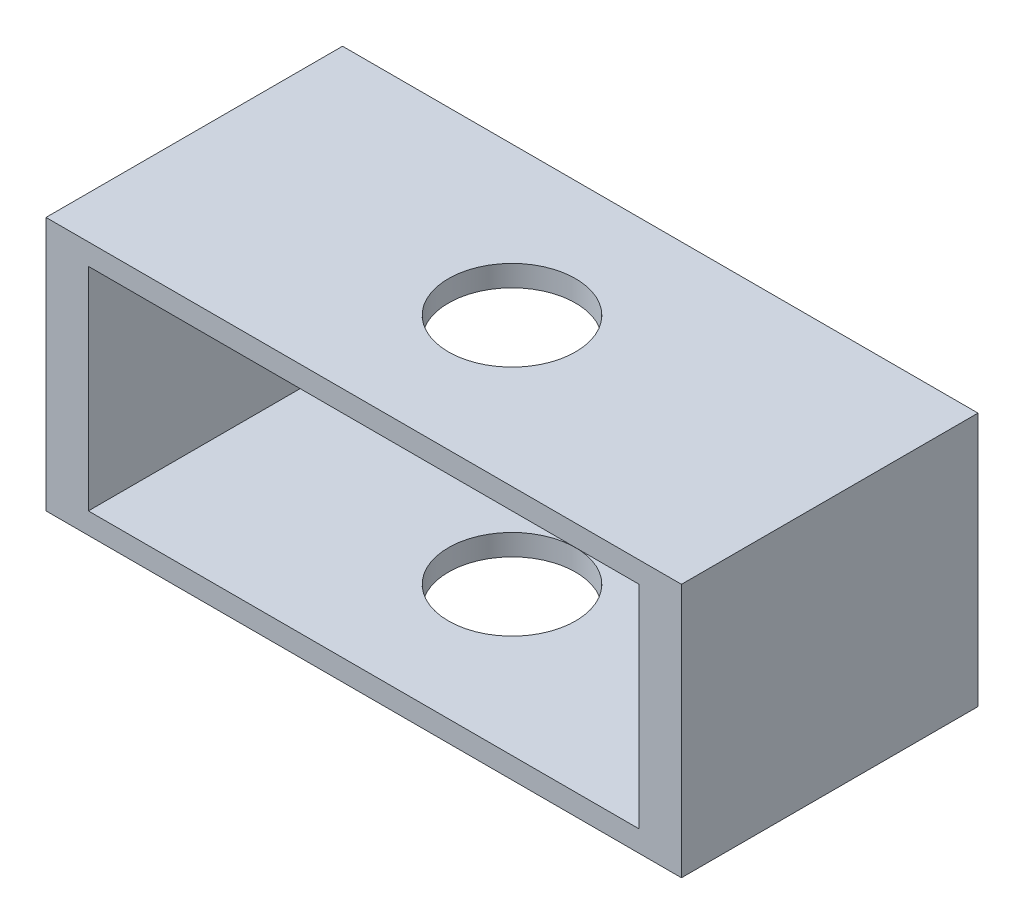
from build123d import *

# Parameters (mm, degrees)
SKETCH_1_W      = 30
SKETCH_1_H      = 14
SKETCH_1_R      = 3
EXTRUDE_1_DEPTH = 1
SKETCH_2_W      = 2
SKETCH_2_H      = 14
EXTRUDE_2_DEPTH = 10
SKETCH_3_W      = 30
SKETCH_3_H      = 14
SKETCH_3_R      = 3
EXTRUDE_3_DEPTH = 1


with BuildPart() as part:
    # Эскиз1 → Бобышка-Вытянуть1 (new body)
    with BuildSketch(Plane(origin=(0, 0, 0), x_dir=(1, 0, 0), z_dir=(0, 1, 0))):
        Rectangle(SKETCH_1_W, SKETCH_1_H)
        with Locations(Location((0, 0, 0), (0, 0, 270))):
            Circle(SKETCH_1_R, mode=Mode.SUBTRACT)
    extrude(amount=EXTRUDE_1_DEPTH)

    # Эскиз2 → Бобышка-Вытянуть2 (add)
    with BuildSketch(Plane(origin=(0, 1, 0), x_dir=(1, 0, 0), z_dir=(0, 1, 0))):
        with Locations((-14, 0)):
            Rectangle(SKETCH_2_W, SKETCH_2_H)
        with Locations((14, 0)):
            Rectangle(SKETCH_2_W, SKETCH_2_H)
    extrude(amount=EXTRUDE_2_DEPTH)

    # Эскиз3 → Бобышка-Вытянуть3 (add)
    with BuildSketch(Plane(origin=(0, 11, 0), x_dir=(1, 0, 0), z_dir=(0, 1, 0))):
        Rectangle(SKETCH_3_W, SKETCH_3_H)
        with Locations(Location((0, 0, 0), (0, 0, 270))):
            Circle(SKETCH_3_R, mode=Mode.SUBTRACT)
    extrude(amount=EXTRUDE_3_DEPTH)


solid = part.part
